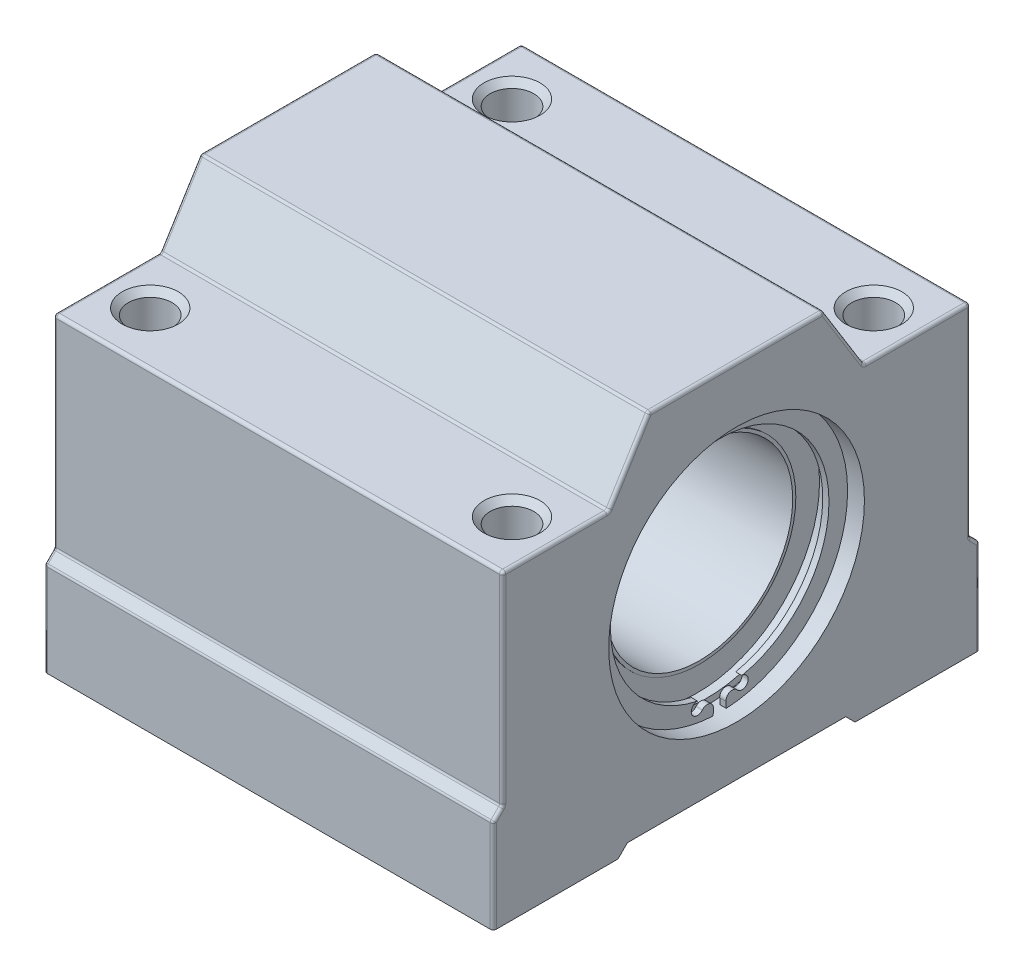
from build123d import *

# Parameters (mm, degrees)
SKETCH1_R           = 20.5
BOSS_EXTRUDE1_DEPTH = 72
EXTRUDE_THIN1_START = 0.5
SKETCH1_4_R         = 15.5
SKETCH1_4_R_2       = 15
EXTRUDE_THIN1_DEPTH = 65.5
BOSS_EXTRUDE2_START = 0.8
SKETCH1_5_R         = 19.5
SKETCH1_5_R_2       = 15
BOSS_EXTRUDE2_DEPTH = 65
BOSS_EXTRUDE3_START = 0.3
SKETCH1_6_R         = 20.5
SKETCH1_6_R_2       = 19.5
BOSS_EXTRUDE3_DEPTH = 67
BOSS_EXTRUDE4_START = 1
BOSS_EXTRUDE4_DEPTH = 1
FILLET1_R           = 0.5
SKETCH4_R           = 3.5
CUT_EXTRUDE3_DEPTH  = 102.218822431
CHAMFER1_SIZE       = 1


with BuildPart() as part:
    # Sketch1 → Boss-Extrude1 (new body)
    with BuildSketch(Plane(origin=(0, 0, 0), x_dir=(0, 0, -1), z_dir=(1, 0, 0))):
        Polygon((-39, -30), (-19, -30), (-17.5, -28.5), (17.5, -28.5), (19, -30), (39, -30), (39, -15), (37.5, -13.5), (37.5, 19), (20.5, 19), (14, 29.5), (-14, 29.5), (-20.5, 19), (-37.5, 19), (-37.5, -13.5), (-39, -15), align=None)
        Circle(SKETCH1_R, mode=Mode.SUBTRACT)
    extrude(amount=BOSS_EXTRUDE1_DEPTH)



with BuildPart() as body_2:
    # Sketch1<4> → Extrude-Thin1 (new body)
    with BuildSketch(Plane(origin=(0, 0, 0), x_dir=(0, 0, -1), z_dir=(1, 0, 0)).offset(EXTRUDE_THIN1_START)):
        Circle(SKETCH1_4_R)
        Circle(SKETCH1_4_R_2, mode=Mode.SUBTRACT)
    extrude(amount=EXTRUDE_THIN1_DEPTH)

    # Sketch1<5> → Boss-Extrude2 (add)
    with BuildSketch(Plane(origin=(0, 0, 0), x_dir=(0, 0, -1), z_dir=(1, 0, 0)).offset(BOSS_EXTRUDE2_START)):
        Circle(SKETCH1_5_R)
        Circle(SKETCH1_5_R_2, mode=Mode.SUBTRACT)
    extrude(amount=BOSS_EXTRUDE2_DEPTH)


with BuildPart() as part_1:
    add(part.part)

    add(body_2.part)  # Boss-Extrude3 merges body 2
    # Sketch1<6> → Boss-Extrude3 (add)
    with BuildSketch(Plane(origin=(0, 0, 0), x_dir=(0, 0, -1), z_dir=(1, 0, 0)).offset(BOSS_EXTRUDE3_START)):
        Circle(SKETCH1_6_R)
        Circle(SKETCH1_6_R_2, mode=Mode.SUBTRACT)
    extrude(amount=BOSS_EXTRUDE3_DEPTH)

    # Sketch3 → Boss-Extrude4 (add)
    with BuildSketch(Plane(origin=(67.3, 0, 0), x_dir=(0, 0, -1), z_dir=(1, 0, 0)).offset(BOSS_EXTRUDE4_START)):
        with BuildLine():
            Line((-1.002970805, -19.474189317), (-1.054405206, -20.472865692))
            ThreePointArc((-1.054405206, -20.472865692), (0, 20.5), (1.054405206, -20.472865692))
            Line((1.054405206, -20.472865692), (1.002970805, -19.474189317))
            ThreePointArc((1.002970805, -19.474189317), (1.634445923, -18.466374638), (2.782979462, -18.775117185))
            ThreePointArc((2.782979462, -18.775117185), (4.46932197, -18.58194631), (3.553015884, -17.153153394))
            ThreePointArc((3.553015884, -17.153153394), (0, 17.517265575), (-3.553015884, -17.153153394))
            ThreePointArc((-3.553015884, -17.153153394), (-4.46932197, -18.58194631), (-2.782979462, -18.775117185))
            ThreePointArc((-2.782979462, -18.775117185), (-1.634445923, -18.466374638), (-1.002970805, -19.474189317))
        make_face()
    extrude(amount=BOSS_EXTRUDE4_DEPTH)

    # Fillet1
    fillet1_edges = [part_1.edges().sort_by_distance(p)[0] for p in [
        (36, -13.5, -37.5),
        (36, -13.5, 37.5),
        (36, -15, 39),
        (36, -15, -39),
        (36, 19, -20.5),
        (36, 19, 20.5),
        (36, 29.5, 14),
        (36, 29.5, -14),
        (36, 19, -37.5),
        (36, 19, 37.5),
        (72, 24.25, -17.25),
        (72, 24.25, 17.25),
        (72, 2.75, 37.5),
        (0, -14.25, 38.25),
        (0, 24.25, 17.25),
        (72, -14.25, -38.25),
        (72, -22.5, -39),
        (72, 2.75, -37.5),
        (72, 29.5, 0),
        (72, 19, -29),
        (72, 19, 29),
        (72, -14.25, 38.25),
        (72, -22.5, 39),
        (0, -22.5, -39),
        (0, -14.25, -38.25),
        (0, 2.75, -37.5),
        (0, 24.25, -17.25),
        (0, 19, -29),
        (0, 29.5, 0),
        (0, -22.5, 39),
        (0, 2.75, 37.5),
        (0, 19, 29),
    ]]
    fillet(fillet1_edges, radius=FILLET1_R)

    # Sketch4 → Cut-Extrude3 (cut, through all)
    with BuildSketch(Plane.XZ.offset(30)):
        with Locations((7, 29)):
            Circle(SKETCH4_R)
        with Locations((65, 29)):
            Circle(SKETCH4_R)
        with Locations((65, -29)):
            Circle(SKETCH4_R)
        with Locations((7, -29)):
            Circle(SKETCH4_R)
    extrude(amount=-CUT_EXTRUDE3_DEPTH, mode=Mode.SUBTRACT)

    # Chamfer1
    chamfer1_edges = [part_1.edges().sort_by_distance(p)[0] for p in [
        (61.5, 19, -29),
        (3.5, 19, -29),
        (3.5, 19, 29),
        (61.5, 19, 29),
        (61.5, -30, 29),
        (3.5, -30, 29),
    ]]
    chamfer(chamfer1_edges, length=CHAMFER1_SIZE)


solid = part_1.part
